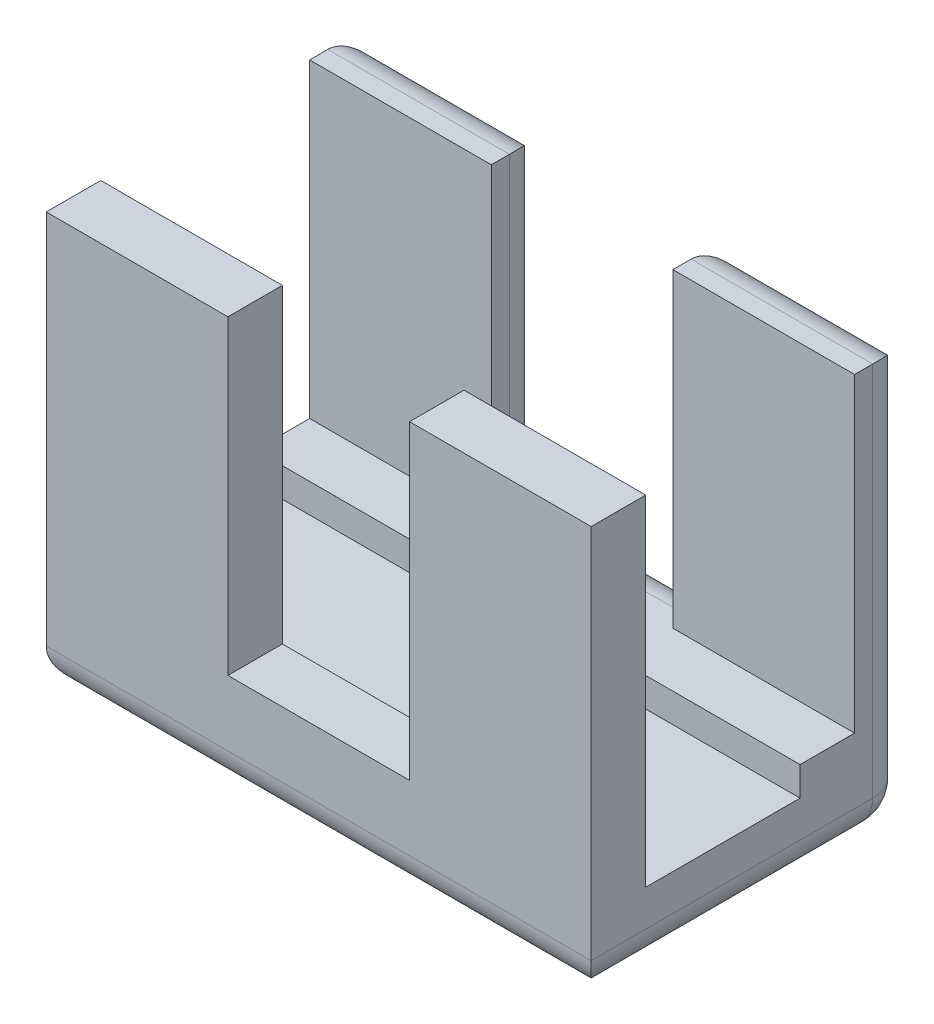
from build123d import *

# Parameters (mm, degrees)
SKETCH1_W           = 30
SKETCH1_H           = 17.5
BOSS_EXTRUDE1_DEPTH = 4
SKETCH2_W           = 30
SKETCH2_H           = 6
BOSS_EXTRUDE2_DEPTH = 1.601
SKETCH3_W           = 10
SKETCH3_H           = 3
BOSS_EXTRUDE3_DEPTH = 18.7
SKETCH4_W           = 10
SKETCH4_H           = 3
BOSS_EXTRUDE4_DEPTH = 17.099
SKETCH5_W           = 10
SKETCH5_H           = 3
BOSS_EXTRUDE5_DEPTH = 1.601
FILLET1_R           = 2


with BuildPart() as part:
    # Sketch1 → Boss-Extrude1 (new body)
    with BuildSketch(Plane(origin=(0, 0, 0), x_dir=(1, 0, 0), z_dir=(0, 1, 0))):
        with Locations((15, 8.75)):
            Rectangle(SKETCH1_W, SKETCH1_H)
    extrude(amount=BOSS_EXTRUDE1_DEPTH)

    # Sketch2 → Boss-Extrude2 (add)
    with BuildSketch(Plane(origin=(0, 4, 0), x_dir=(1, 0, 0), z_dir=(0, 1, 0))):
        with Locations((15, 14.5)):
            Rectangle(SKETCH2_W, SKETCH2_H)
    extrude(amount=BOSS_EXTRUDE2_DEPTH)

    # Sketch3 → Boss-Extrude3 (add)
    with BuildSketch(Plane(origin=(0, 4, 0), x_dir=(1, 0, 0), z_dir=(0, 1, 0))):
        with Locations((5, 1.5)):
            Rectangle(SKETCH3_W, SKETCH3_H)
        with Locations((25, 1.5)):
            Rectangle(SKETCH3_W, SKETCH3_H)
    extrude(amount=BOSS_EXTRUDE3_DEPTH)

    # Sketch4 → Boss-Extrude4 (add)
    with BuildSketch(Plane(origin=(0, 5.601, 0), x_dir=(1, 0, 0), z_dir=(0, 1, 0))):
        with Locations((5, 16)):
            Rectangle(SKETCH4_W, SKETCH4_H)
        with Locations((25, 16)):
            Rectangle(SKETCH4_W, SKETCH4_H)
    extrude(amount=BOSS_EXTRUDE4_DEPTH)

    # Sketch5 → Boss-Extrude5 (add)
    with BuildSketch(Plane(origin=(0, 4, 0), x_dir=(1, 0, 0), z_dir=(0, 1, 0))):
        with Locations((15, 1.5)):
            Rectangle(SKETCH5_W, SKETCH5_H)
    extrude(amount=BOSS_EXTRUDE5_DEPTH)

    # Fillet1
    fillet1_edges = [part.edges().sort_by_distance(p)[0] for p in [
        (15, 0, -17.5),
        (30, 0, -8.75),
        (15, 0, 0),
        (10, 14.1505, -17.5),
        (5, 22.7, -17.5),
        (0, 0, -8.75),
        (15, 5.601, -17.5),
        (20, 14.1505, -17.5),
        (25, 22.7, -17.5),
        (0, 11.35, -17.5),
        (30, 11.35, -17.5),
    ]]
    fillet(fillet1_edges, radius=FILLET1_R)


solid = part.part
